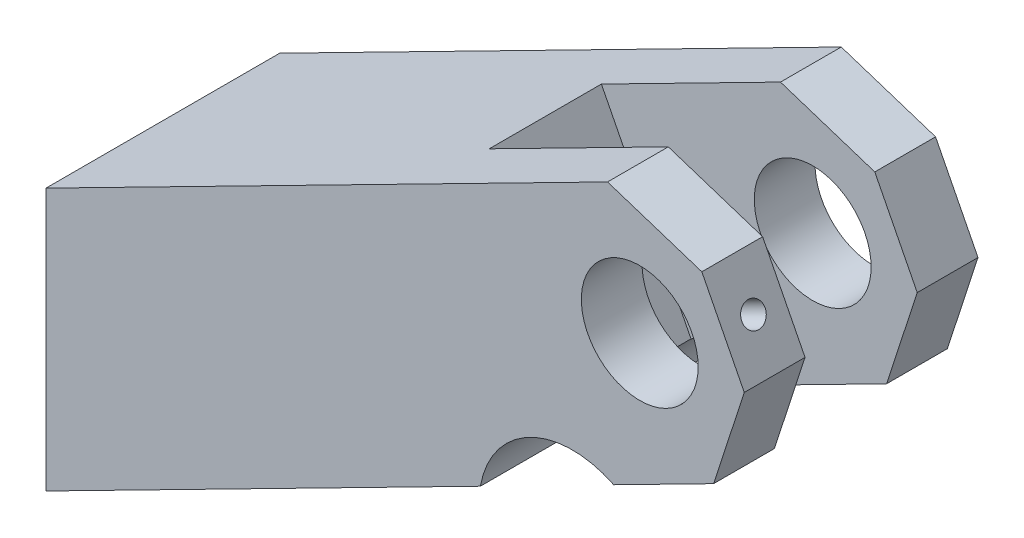
from build123d import *

# Parameters (mm, degrees)
AUFSATZ_LINEAR_AUSTRAGEN1_DEPTH  = 25
SCHNITT_LINEAR_AUSTRAGEN1_DEPTH  = 12
F_25_0_25_DURCHMESSER_BOHRUNG1_D = 25
M6_GEWINDEBOHRUNG1_D             = 5
M6_GEWINDEBOHRUNG1_DEPTH         = 17
M6_GEWINDEBOHRUNG1_TIP           = 1.502151548
M12_GEWINDEBOHRUNG1_D            = 10.2
M12_GEWINDEBOHRUNG1_DEPTH        = 25
M12_GEWINDEBOHRUNG1_TIP          = 3.064389157


with BuildPart() as part:
    # Skizze1 → Aufsatz-Linear austragen1 (new, symmetric)
    with BuildSketch(Plane.XY):
        with BuildLine():
            Line((0, 0), (120.12882084, 61.208691436))
            Line((120.12882084, 61.208691436), (140.303776199, 54.653451069))
            Line((140.303776199, 54.653451069), (149.383586194, 36.833320585))
            Line((149.383586194, 36.833320585), (142.828345827, 16.658365227))
            Line((142.828345827, 16.658365227), (121.444189247, 5.762593233))
            ThreePointArc((121.444189247, 5.762593233), (103.556160862, 5.62679743), (92.931980473, -8.765102759))
            Line((92.931980473, -8.765102759), (0, -56.116311882))
            Line((0, -56.116311882), (0, 0))
        make_face()
    extrude(amount=AUFSATZ_LINEAR_AUSTRAGEN1_DEPTH, both=True)

    # Skizze2 → Schnitt-Linear austragen1 (cut, symmetric)
    with BuildSketch(Plane.XY):
        Polygon((133.493918703, 68.018548932), (81.8155403, 41.687099947), (104.515065287, -2.863226262), (156.19344369, 23.468222723), align=None)
    extrude(amount=SCHNITT_LINEAR_AUSTRAGEN1_DEPTH, both=True, mode=Mode.SUBTRACT)

    # Ø25.0 (25) Durchmesser Bohrung1 (through all)
    with Locations(Plane.XY.offset(25)):
        with Locations((127.023550713, 36.663575833)):
            Hole(F_25_0_25_DURCHMESSER_BOHRUNG1_D / 2)

    # M6 Gewindebohrung1
    with Locations(Plane(origin=(133.493918703, 68.018548932, 0), x_dir=(0, 0, -1), z_dir=(0.8910065241883688, 0.4539904997395451, 0))):
        with Locations((-18.5, -25)):
            Hole(M6_GEWINDEBOHRUNG1_D / 2, depth=M6_GEWINDEBOHRUNG1_DEPTH)
            with Locations((0, 0, -(M6_GEWINDEBOHRUNG1_DEPTH + M6_GEWINDEBOHRUNG1_TIP / 2))):  # 118° drill point
                Cone(0, M6_GEWINDEBOHRUNG1_D / 2, M6_GEWINDEBOHRUNG1_TIP, mode=Mode.SUBTRACT)

    # M12 Gewindebohrung1
    with Locations(Plane.ZY):
        with Locations((-12.5, -12), (12.5, -12), (0, -32)):
            Hole(M12_GEWINDEBOHRUNG1_D / 2, depth=M12_GEWINDEBOHRUNG1_DEPTH)
            with Locations((0, 0, -(M12_GEWINDEBOHRUNG1_DEPTH + M12_GEWINDEBOHRUNG1_TIP / 2))):  # 118° drill point
                Cone(0, M12_GEWINDEBOHRUNG1_D / 2, M12_GEWINDEBOHRUNG1_TIP, mode=Mode.SUBTRACT)


solid = part.part
